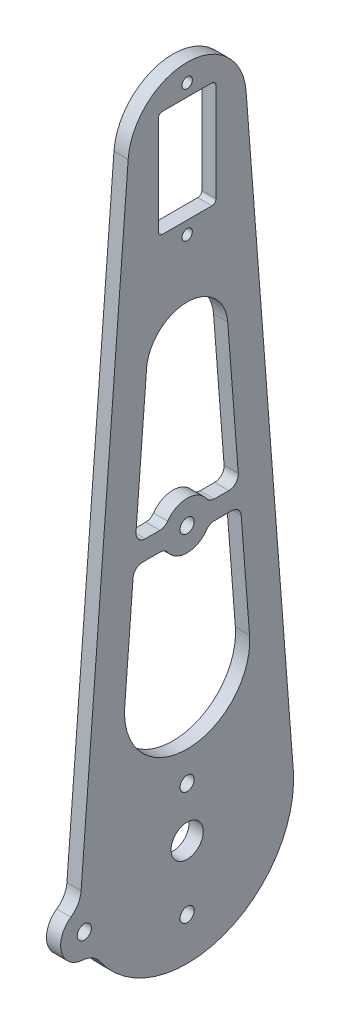
from build123d import *

# Parameters (mm, degrees)
BOSS_EXTRUDE1_DEPTH = 3
CUT_EXTRUDE1_REACH  = 169.024
SKETCH3_R           = 1.1
CUT_EXTRUDE2_REACH  = 169.024
SKETCH5_R           = 3.4
CUT_EXTRUDE3_REACH  = 169.024
SKETCH7_R           = 1.5
BOSS_EXTRUDE3_DEPTH = 3
FILLET1_R           = 2
SKETCH8_R           = 5
BOSS_EXTRUDE4_DEPTH = 3
CUT_EXTRUDE4_REACH  = 169.024
SKETCH9_R           = 1.5
FILLET2_R           = 5
CUT_EXTRUDE5_REACH  = 169.024
SKETCH10_R          = 1.5


with BuildPart() as part:
    # Sketch1 → Boss-Extrude1 (new body)
    with BuildSketch(Plane(origin=(-22.718758449, 0, 0), x_dir=(0, 0, -1), z_dir=(1, 0, 0))):
        with BuildLine():
            Line((33.252275896, 149.750258484), (43.222646201, 20.519489254))
            ThreePointArc((43.222646201, 20.519489254), (20.789313015, -3.711279977), (-1.644020172, 20.519489254))
            Line((-1.644020172, 20.519489254), (8.326350133, 149.750258484))
            ThreePointArc((8.326350133, 149.750258484), (20.789313015, 161.288720023), (33.252275896, 149.750258484))
        make_face()
    extrude(amount=BOSS_EXTRUDE1_DEPTH)

    # Sketch3 → Cut-Extrude1 (cut, up to next)
    with BuildSketch(Plane(origin=(-19.718758449, 0, 0), x_dir=(0, 0, -1), z_dir=(1, 0, 0)), mode=Mode.PRIVATE) as cut_extrude1_sk1:
        with Locations((20.789313015, 157.538720023)):
            Circle(SKETCH3_R)
    cut_extrude1_tool1 = extrude(cut_extrude1_sk1.sketch, amount=-CUT_EXTRUDE1_REACH, mode=Mode.PRIVATE) & part.part
    # Sketch3 → Cut-Extrude1 (cut, up to next)
    with BuildSketch(Plane(origin=(-19.718758449, 0, 0), x_dir=(0, 0, -1), z_dir=(1, 0, 0)), mode=Mode.PRIVATE) as cut_extrude1_sk2:
        with Locations((20.789313015, 129.738720023)):
            Circle(SKETCH3_R)
    cut_extrude1_tool2 = extrude(cut_extrude1_sk2.sketch, amount=-CUT_EXTRUDE1_REACH, mode=Mode.PRIVATE) & part.part
    # Sketch3 → Cut-Extrude1 (cut, up to next)
    with BuildSketch(Plane(origin=(-19.718758449, 0, 0), x_dir=(0, 0, -1), z_dir=(1, 0, 0)), mode=Mode.PRIVATE) as cut_extrude1_sk3:
        with BuildLine():
            Line((14.689313015, 154.038720023), (14.689313015, 148.788720023))
            Line((14.689313015, 148.788720023), (14.689313015, 133.238720023))
            ThreePointArc((14.689313015, 133.238720023), (14.938272251, 132.637679259), (15.539313015, 132.388720023))
            Line((15.539313015, 132.388720023), (26.039313015, 132.388720023))
            ThreePointArc((26.039313015, 132.388720023), (26.640353779, 132.637679259), (26.889313015, 133.238720023))
            Line((26.889313015, 133.238720023), (26.889313015, 148.788720023))
            Line((26.889313015, 148.788720023), (26.889313015, 154.038720023))
            ThreePointArc((26.889313015, 154.038720023), (26.640353779, 154.639760787), (26.039313015, 154.888720023))
            Line((26.039313015, 154.888720023), (20.789313015, 154.888720023))
            Line((20.789313015, 154.888720023), (15.539313015, 154.888720023))
            ThreePointArc((15.539313015, 154.888720023), (14.938272251, 154.639760787), (14.689313015, 154.038720023))
        make_face()
    cut_extrude1_tool3 = extrude(cut_extrude1_sk3.sketch, amount=-CUT_EXTRUDE1_REACH, mode=Mode.PRIVATE) & part.part
    add(cut_extrude1_tool1.solids().sort_by_distance((-19.718758, 157.53872, -20.789313))[0], mode=Mode.SUBTRACT)
    add(cut_extrude1_tool2.solids().sort_by_distance((-19.718758, 129.73872, -20.789313))[0], mode=Mode.SUBTRACT)
    add(cut_extrude1_tool3.solids().sort_by_distance((-19.718758, 143.63872, -20.789313))[0], mode=Mode.SUBTRACT)

    # Sketch5 → Cut-Extrude2 (cut, up to next)
    with BuildSketch(Plane(origin=(-19.718758449, 0, 0), x_dir=(0, 0, -1), z_dir=(1, 0, 0)), mode=Mode.PRIVATE) as cut_extrude2_sk1:
        with Locations((20.789313015, 18.788720023)):
            Circle(SKETCH5_R)
    cut_extrude2_tool1 = extrude(cut_extrude2_sk1.sketch, amount=-CUT_EXTRUDE2_REACH, mode=Mode.PRIVATE) & part.part
    add(cut_extrude2_tool1.solids().sort_by_distance((-19.718758, 18.78872, -20.789313))[0], mode=Mode.SUBTRACT)

    # Sketch6 → Cut-Extrude3 (cut, up to next)
    with BuildSketch(Plane.ZY.offset(22.718758449), mode=Mode.PRIVATE) as cut_extrude3_sk1:
        with BuildLine():
            Line((-12.212541883, 109.452410499), (-7.597239032, 49.809553356))
            ThreePointArc((-7.597239032, 49.809553356), (-20.789313015, 35.557207763), (-33.981386998, 49.809553356))
            Line((-33.981386998, 49.809553356), (-29.366084146, 109.452410499))
            ThreePointArc((-29.366084146, 109.452410499), (-20.789313015, 117.391131783), (-12.212541883, 109.452410499))
        make_face()
    cut_extrude3_tool1 = extrude(cut_extrude3_sk1.sketch, amount=-CUT_EXTRUDE3_REACH, mode=Mode.PRIVATE) & part.part
    add(cut_extrude3_tool1.solids().sort_by_distance((-22.718758, 73.705728, -20.789313))[0], mode=Mode.SUBTRACT)

    # Sketch7 → Boss-Extrude3 (add)
    with BuildSketch(Plane.ZY.offset(22.718758449)):
        with BuildLine():
            Line((-32.072781677, 74.474169773), (-25.37188871, 74.474169773))
            ThreePointArc((-25.37188871, 74.474169773), (-20.789313015, 71.474169773), (-16.20673732, 74.474169773))
            Line((-16.20673732, 74.474169773), (-9.505844352, 74.474169773))
            Line((-9.505844352, 74.474169773), (-9.815373645, 78.474169773))
            Line((-9.815373645, 78.474169773), (-16.20673732, 78.474169773))
            ThreePointArc((-16.20673732, 78.474169773), (-20.789313015, 81.474169773), (-25.37188871, 78.474169773))
            Line((-25.37188871, 78.474169773), (-31.763252384, 78.474169773))
            Line((-31.763252384, 78.474169773), (-32.072781677, 74.474169773))
        make_face()
        with Locations((-20.789313015, 76.474169773)):
            Circle(SKETCH7_R, mode=Mode.SUBTRACT)
    extrude(amount=-BOSS_EXTRUDE3_DEPTH)

    # Fillet1
    fillet1_edges = [part.edges().sort_by_distance(p)[0] for p in [
        (-21.218758449, 74.474169773, -32.072781677),
        (-21.218758449, 78.474169773, -31.763252384),
        (-21.218758449, 78.474169773, -25.37188871),
        (-21.218758449, 78.474169773, -16.20673732),
        (-21.218758449, 78.474169773, -9.815373645),
        (-21.218758449, 74.474169773, -9.505844352),
        (-21.218758449, 74.474169773, -16.20673732),
        (-21.218758449, 74.474169773, -25.37188871),
    ]]
    fillet(fillet1_edges, radius=FILLET1_R)

    # Sketch8 → Boss-Extrude4 (add)
    with BuildSketch(Plane.ZY.offset(22.718758449)):
        with Locations((0.944018077, 12.965291508)):
            Circle(SKETCH8_R)
    extrude(amount=-BOSS_EXTRUDE4_DEPTH)

    # Sketch9 → Cut-Extrude4 (cut, up to next)
    with BuildSketch(Plane.ZY.offset(22.718758449), mode=Mode.PRIVATE) as cut_extrude4_sk1:
        with Locations((0.944018077, 12.965291508)):
            Circle(SKETCH9_R)
    cut_extrude4_tool1 = extrude(cut_extrude4_sk1.sketch, amount=-CUT_EXTRUDE4_REACH, mode=Mode.PRIVATE) & part.part
    add(cut_extrude4_tool1.solids().sort_by_distance((-22.718758, 12.965292, 0.944018))[0], mode=Mode.SUBTRACT)

    # Fillet2
    fillet2_edges = [part.edges().sort_by_distance(p)[0] for p in [
        (-21.218758449, 17.908803886, 1.693474793),
        (-21.218758449, 8.309355847, -0.878689557),
    ]]
    fillet(fillet2_edges, radius=FILLET2_R)

    # Sketch10 → Cut-Extrude5 (cut, up to next)
    with BuildSketch(Plane.ZY.offset(22.718758449), mode=Mode.PRIVATE) as cut_extrude5_sk1:
        with Locations((-20.789313015, 29.288720023)):
            Circle(SKETCH10_R)
    cut_extrude5_tool1 = extrude(cut_extrude5_sk1.sketch, amount=-CUT_EXTRUDE5_REACH, mode=Mode.PRIVATE) & part.part
    # Sketch10 → Cut-Extrude5 (cut, up to next)
    with BuildSketch(Plane.ZY.offset(22.718758449), mode=Mode.PRIVATE) as cut_extrude5_sk2:
        with Locations((-20.789313015, 5.288720023)):
            Circle(SKETCH10_R)
    cut_extrude5_tool2 = extrude(cut_extrude5_sk2.sketch, amount=-CUT_EXTRUDE5_REACH, mode=Mode.PRIVATE) & part.part
    add(cut_extrude5_tool1.solids().sort_by_distance((-22.718758, 29.28872, -20.789313))[0], mode=Mode.SUBTRACT)
    add(cut_extrude5_tool2.solids().sort_by_distance((-22.718758, 5.28872, -20.789313))[0], mode=Mode.SUBTRACT)


solid = part.part
